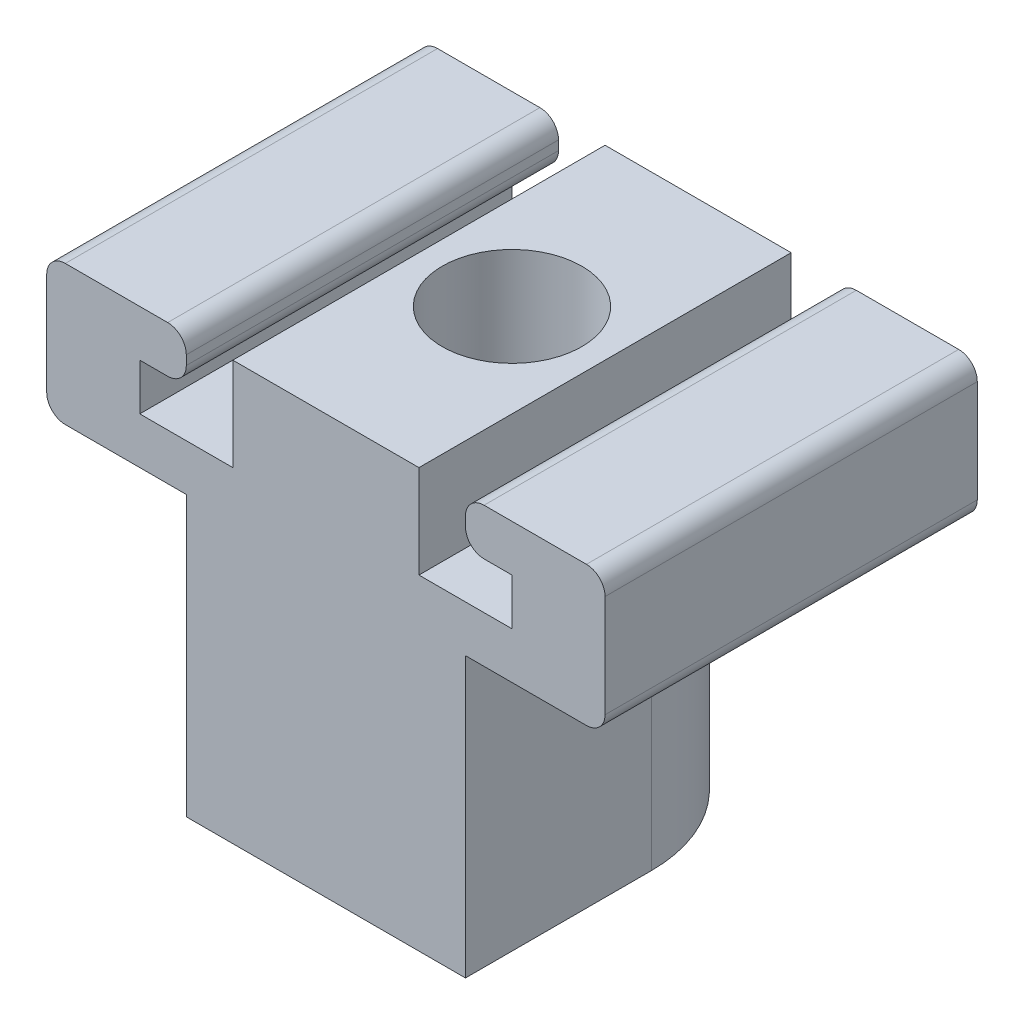
from build123d import *

# Parameters (mm, degrees)
SKETCH1_W           = 38.1
SKETCH1_H           = 25.4
BOSS_EXTRUDE1_DEPTH = 9.525
CUT_EXTRUDE1_REACH  = 35.148
BOSS_EXTRUDE2_DEPTH = 19.05
CUT_EXTRUDE3_REACH  = 38.616
SKETCH5_R           = 4.7625
SKETCH4_R           = 7.14375
CUT_EXTRUDE2_DEPTH  = 19.05
FILLET2_R           = 1.27


with BuildPart() as part:
    # Sketch1 → Boss-Extrude1 (new body)
    with BuildSketch(Plane(origin=(0, 0, 0), x_dir=(1, 0, 0), z_dir=(0, 1, 0))):
        Rectangle(SKETCH1_W, SKETCH1_H)
    extrude(amount=BOSS_EXTRUDE1_DEPTH)

    # Sketch2 → Cut-Extrude1 (cut, up to next)
    with BuildSketch(Plane(origin=(0, 0, -12.7), x_dir=(-1, 0, 0), z_dir=(0, 0, -1)), mode=Mode.PRIVATE) as cut_extrude1_sk1:
        Polygon((-9.525, 9.525), (-9.525, 6.35), (-12.7, 6.35), (-12.7, 3.175), (-6.35, 3.175), (-6.35, 9.525), align=None)
    cut_extrude1_tool1 = extrude(cut_extrude1_sk1.sketch, amount=-CUT_EXTRUDE1_REACH, mode=Mode.PRIVATE) & part.part
    cut_extrude1 = cut_extrude1_tool1.solids().sort_by_distance((8.995833, 5.820833, -12.7))[0]
    add(cut_extrude1, mode=Mode.SUBTRACT)

    # Mirror1: Cut-Extrude1 across plane
    add(cut_extrude1.mirror(Plane(origin=(0, 0, 0), x_dir=(0, 0, 1), z_dir=(1, 0, 0))), mode=Mode.SUBTRACT)

    # Sketch3 → Boss-Extrude2 (add)
    with BuildSketch(Plane.XZ):
        with BuildLine():
            Line((9.525, 0), (9.525, 12.7))
            Line((9.525, 12.7), (-9.525, 12.7))
            Line((-9.525, 12.7), (-9.525, 0))
            ThreePointArc((-9.525, 0), (0, -9.525), (9.525, 0))
        make_face()
    extrude(amount=BOSS_EXTRUDE2_DEPTH)

    # Sketch5 → Cut-Extrude3 (cut, up to next)
    with BuildSketch(Plane(origin=(0, -19.05, 0), x_dir=(-1, 0, 0), z_dir=(0, -1, 0)), mode=Mode.PRIVATE) as cut_extrude3_sk1:
        with Locations(Location((0, 0, 0), (0, 0, 90))):
            Circle(SKETCH5_R)
    cut_extrude3_tool1 = extrude(cut_extrude3_sk1.sketch, amount=-CUT_EXTRUDE3_REACH, mode=Mode.PRIVATE) & part.part
    add(cut_extrude3_tool1.solids().sort_by_distance((0, -19.05, 0))[0], mode=Mode.SUBTRACT)

    # Sketch4 → Cut-Extrude2 (cut)
    with BuildSketch(Plane.XZ.offset(19.05)):
        with Locations(Location((0, 0, 0), (0, 0, 270))):
            Circle(SKETCH4_R)
    extrude(amount=-CUT_EXTRUDE2_DEPTH, mode=Mode.SUBTRACT)

    # Fillet2
    fillet2_edges = [part.edges().sort_by_distance(p)[0] for p in [
        (19.05, 0, 0),
        (-19.05, 0, 0),
        (-19.05, 9.525, 0),
        (19.05, 9.525, 0),
        (9.525, 6.35, 0),
        (9.525, 9.525, 0),
        (-9.525, 6.35, 0),
        (-9.525, 9.525, 0),
    ]]
    fillet(fillet2_edges, radius=FILLET2_R)


solid = part.part
